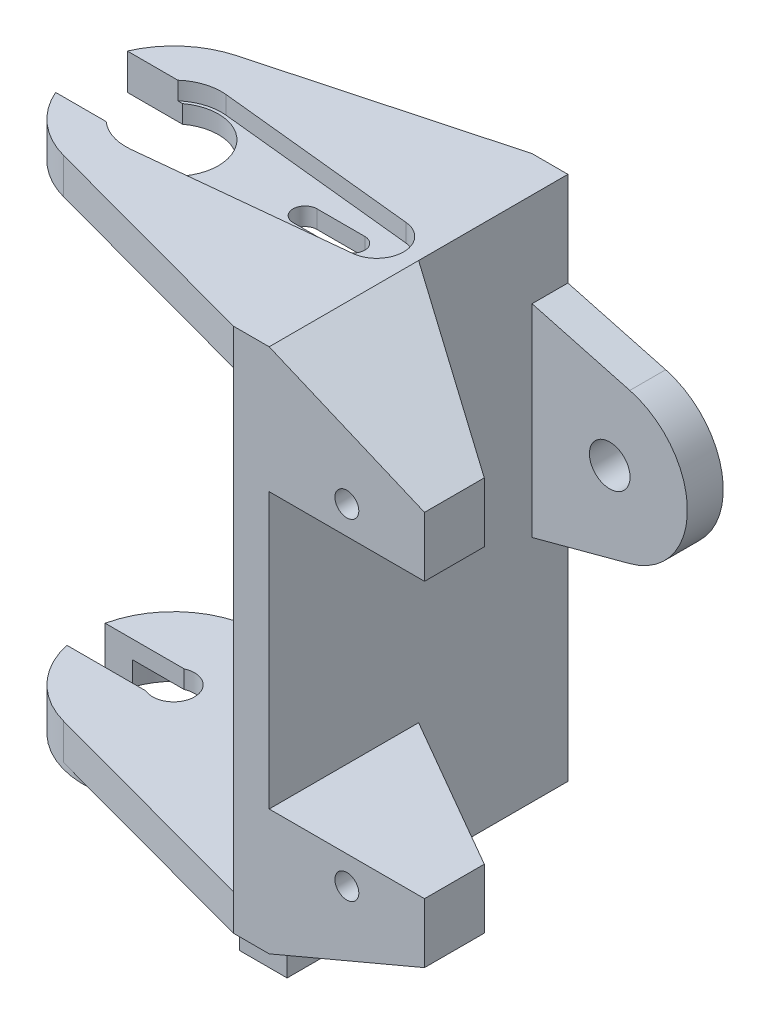
from build123d import *

# Parameters (mm, degrees)
ESBO_O1_R                  = 1
RESSALTO_EXTRUS_O1_DEPTH   = 12.5
CORTE_EXTRUS_O1_DEPTH      = 15
CORTE_EXTRUS_O2_DEPTH      = 49.656962503
CORTE_EXTRUS_O2_DEPTH_BACK = 49.656962503
ESBO_O5_R                  = 1.7
RESSALTO_EXTRUS_O2_DEPTH   = 3
CORTE_EXTRUS_O3_DEPTH      = 10
CORTE_EXTRUS_O4_DEPTH      = 57.402570863
RESSALTO_EXTRUS_O3_START   = -4
RESSALTO_EXTRUS_O3_DEPTH   = 4
ESBO_O9_R                  = 5.3
CORTE_EXTRUS_O5_DEPTH      = 1.5
RESSALTO_EXTRUS_O4_DEPTH   = 0.5
CORTE_EXTRUS_O6_DEPTH      = 1.5


with BuildPart() as part:
    # Esboço1 → Ressalto-extrusão1 (new, symmetric)
    with BuildSketch(Plane.XY):
        Polygon((0, -22), (-33, -22), (-33, -19), (-3, -19), (-3, 19), (-33, 19), (-33, 22), (0, 22), (13, 16.5), (13, 11.5), (0, 11.5), (0, -11.5), (13, -11.5), (13, -16.5), align=None)
        with Locations((6.5, 13.85)):
            Circle(ESBO_O1_R, mode=Mode.SUBTRACT)
        with Locations((6.5, -13.85)):
            Circle(ESBO_O1_R, mode=Mode.SUBTRACT)
    extrude(amount=RESSALTO_EXTRUS_O1_DEPTH, both=True)

    # Esboço2 → Corte-extrusão1 (cut)
    with BuildSketch(Plane(origin=(0, 22, 0), x_dir=(1, 0, 0), z_dir=(0, 1, 0))):
        with BuildLine():
            Line((-22.45722521, 7.240115294), (-3, 12.5))
            Line((-3, 12.5), (-33, 12.5))
            Line((-33, 12.5), (-33, -12.5))
            Line((-33, -12.5), (-3, -12.5))
            Line((-3, -12.5), (-22.45722521, -7.240115294))
            ThreePointArc((-22.45722521, -7.240115294), (-25.398129905, -5.679641136), (-27.373863542, -3))
            Line((-27.373863542, -3), (-22.75, -3))
            ThreePointArc((-22.75, -3), (-16.75, 0), (-22.75, 3))
            Line((-22.75, 3), (-27.373863542, 3))
            ThreePointArc((-27.373863542, 3), (-25.398129905, 5.679641136), (-22.45722521, 7.240115294))
        make_face()
        with BuildLine():
            Line((-5.5, 1), (-9.5, 1))
            ThreePointArc((-9.5, 1), (-10.5, 0), (-9.5, -1))
            Line((-9.5, -1), (-5.5, -1))
            ThreePointArc((-5.5, -1), (-4.5, 0), (-5.5, 1))
        make_face()
    extrude(amount=-CORTE_EXTRUS_O1_DEPTH, mode=Mode.SUBTRACT)

    # Esboço4 → Corte-extrusão2 (cut, two sides: drawn at the far end of the back side and taken through both)
    with BuildSketch(Plane(origin=(0, -11.5, 0), x_dir=(1, 0, 0), z_dir=(0, 1, 0)).offset(-CORTE_EXTRUS_O2_DEPTH_BACK)):
        Polygon((13, -7.5), (0, 0.005553499), (0, 12.5), (13, 12.5), align=None)
    extrude(amount=CORTE_EXTRUS_O2_DEPTH + CORTE_EXTRUS_O2_DEPTH_BACK, mode=Mode.SUBTRACT)

    # Esboço5 → Ressalto-extrusão2 (add)
    with BuildSketch(Plane(origin=(0, 0, -12.5), x_dir=(-1, 0, 0), z_dir=(0, 0, -1))):
        with BuildLine():
            Line((-8.182323793, 11.928517871), (0, 14.120964923))
            Line((0, 14.120964923), (0, -2.820964923))
            Line((0, -2.820964923), (-8.182323793, -0.628517871))
            ThreePointArc((-8.182323793, -0.628517871), (-13, 5.65), (-8.182323793, 11.928517871))
        make_face()
        with Locations((-6.5, 5.65)):
            Circle(ESBO_O5_R, mode=Mode.SUBTRACT)
    extrude(amount=-RESSALTO_EXTRUS_O2_DEPTH)

    # Esboço7 → Corte-extrusão3 (cut)
    with BuildSketch(Plane(origin=(0, -19, 0), x_dir=(1, 0, 0), z_dir=(0, 1, 0))):
        with BuildLine():
            Line((-21.208872344, 1.6), (-33, 1.6))
            Line((-33, 1.6), (-33, -1.6))
            Line((-33, -1.6), (-21.208872344, -1.6))
            ThreePointArc((-21.208872344, -1.6), (-18.75, 0), (-21.208872344, 1.6))
        make_face()
    extrude(amount=-CORTE_EXTRUS_O3_DEPTH, mode=Mode.SUBTRACT)

    # Esboço2<2> → Corte-extrusão4 (cut, through all)
    with BuildSketch(Plane(origin=(0, 22, 0), x_dir=(1, 0, 0), z_dir=(0, 1, 0))):
        with BuildLine():
            Line((-22.45722521, 7.240115294), (-3, 12.5))
            Line((-3, 12.5), (-33, 12.5))
            Line((-33, 12.5), (-33, -12.5))
            Line((-33, -12.5), (-3, -12.5))
            Line((-3, -12.5), (-22.45722521, -7.240115294))
            ThreePointArc((-22.45722521, -7.240115294), (-25.398129905, -5.679641136), (-27.373863542, -3))
            ThreePointArc((-27.373863542, -3), (-28, 0), (-27.373863542, 3))
            ThreePointArc((-27.373863542, 3), (-25.398129905, 5.679641136), (-22.45722521, 7.240115294))
        make_face()
    extrude(amount=-CORTE_EXTRUS_O4_DEPTH, mode=Mode.SUBTRACT)

    # Esboço8 → Ressalto-extrusão3 (add)
    with BuildSketch(Plane(origin=(0, 0, 0), x_dir=(0, 0, -1), z_dir=(1, 0, 0)).offset(RESSALTO_EXTRUS_O3_START)):
        Polygon((10, -21.5), (3, -28.5), (-7, -28.5), (-7, -25.5), (-5, -24), (-5, -25.5), (1.757359313, -25.5), (5.757359313, -21.5), align=None)
    extrude(amount=-RESSALTO_EXTRUS_O3_DEPTH)

    # Esboço9 → Corte-extrusão5 (cut)
    with BuildSketch(Plane(origin=(0, -22, 0), x_dir=(-1, 0, 0), z_dir=(0, -1, 0))):
        with Locations((20.5, 0)):
            Circle(ESBO_O9_R)
    extrude(amount=-CORTE_EXTRUS_O5_DEPTH, mode=Mode.SUBTRACT)

    # Esboço10 → Ressalto-extrusão4 (add)
    with BuildSketch(Plane.XZ.offset(22)):
        with BuildLine():
            Line((-27.827346041, 1.6), (-25.552722039, 1.6))
            ThreePointArc((-25.552722039, 1.6), (-15.2, 0), (-25.552722039, -1.6))
            Line((-25.552722039, -1.6), (-27.827346041, -1.6))
            ThreePointArc((-27.827346041, -1.6), (-13, 0), (-27.827346041, 1.6))
        make_face()
    extrude(amount=RESSALTO_EXTRUS_O4_DEPTH)

    # Esboço11 → Corte-extrusão6 (cut)
    with BuildSketch(Plane(origin=(0, 22, 0), x_dir=(1, 0, 0), z_dir=(0, 1, 0))):
        with BuildLine():
            Line((-20.088235294, 3.978749782), (-3.268382353, 2.238046752))
            ThreePointArc((-3.268382353, 2.238046752), (-1.25, 0), (-3.268382353, -2.238046752))
            Line((-3.268382353, -2.238046752), (-20.088235294, -3.978749782))
            ThreePointArc((-20.088235294, -3.978749782), (-24.5, 0), (-20.088235294, 3.978749782))
        make_face()
    extrude(amount=-CORTE_EXTRUS_O6_DEPTH, mode=Mode.SUBTRACT)


solid = part.part
